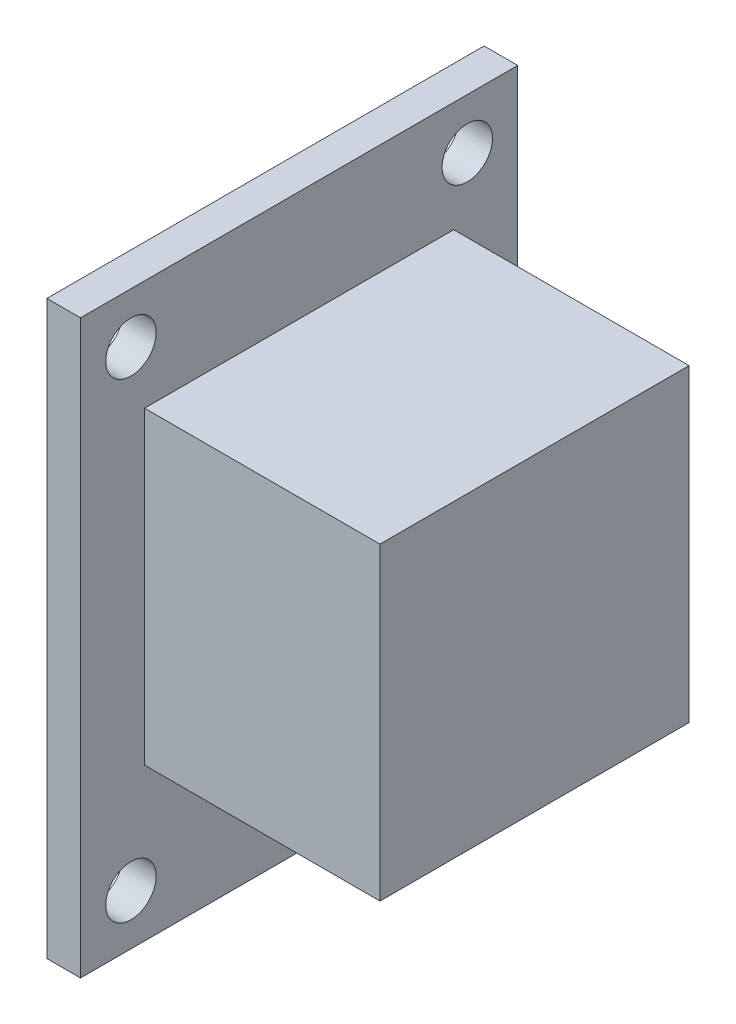
from build123d import *

# Parameters (mm, degrees)
SKETCH_1_W          = 18.38477631
SKETCH_1_H          = 18.38477631
EXTRUDE_2_DEPTH     = 14
SKETCH_5_W          = 26
SKETCH_5_H          = 34
EXTRUDE_4_DEPTH     = 2
SKETCH_6_R          = 1.5
CUT_EXTRUDE_1_DEPTH = 2


with BuildPart() as part:
    # 草图1 → 凸台-拉伸2 (new body)
    with BuildSketch(Plane(origin=(0, 0, 0), x_dir=(0, 0, -1), z_dir=(1, 0, 0))):
        with Locations((0, 1.25)):
            Rectangle(SKETCH_1_W, SKETCH_1_H)
    extrude(amount=EXTRUDE_2_DEPTH)

    # 草图5 → 凸台-拉伸4 (add)
    with BuildSketch(Plane.ZY):
        Rectangle(SKETCH_5_W, SKETCH_5_H)
    extrude(amount=EXTRUDE_4_DEPTH)

    # 草图6 → 切除-拉伸1 (cut)
    with BuildSketch(Plane(origin=(0, 0, 0), x_dir=(0, 0, -1), z_dir=(1, 0, 0))):
        with Locations((-10, 14)):
            Circle(SKETCH_6_R)
        with Locations((10, 14)):
            Circle(SKETCH_6_R)
        with Locations((-10, -14)):
            Circle(SKETCH_6_R)
        with Locations((10, -14)):
            Circle(SKETCH_6_R)
    extrude(amount=-CUT_EXTRUDE_1_DEPTH, mode=Mode.SUBTRACT)


solid = part.part
